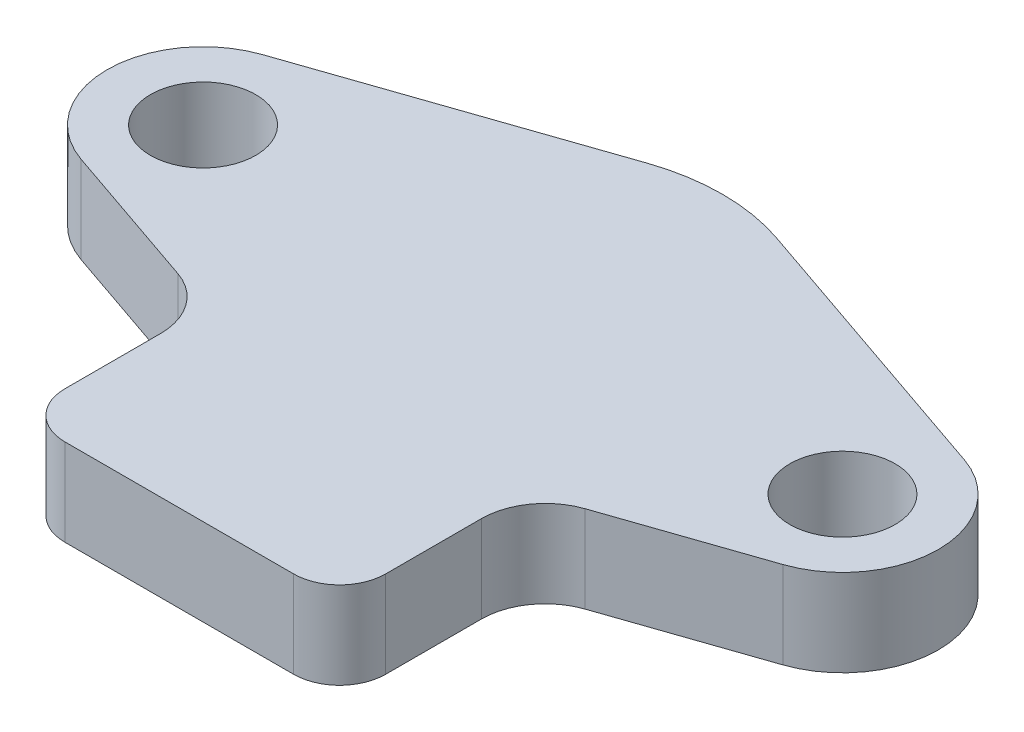
from build123d import *

# Parameters (mm, degrees)
BOSS_EXTRUDE1_DEPTH = 1.143
SKETCH2_R           = 2.6162
BOSS_EXTRUDE2_DEPTH = 3.175


with BuildPart() as part:
    # Sketch1 → Boss-Extrude1 (new body)
    with BuildSketch(Plane(origin=(0, 0, 0), x_dir=(1, 0, 0), z_dir=(0, 1, 0))):
        with BuildLine():
            Line((-7.9629, -10.019330915), (-7.9629, -14.7701))
            ThreePointArc((-7.9629, -14.7701), (-7.293346102, -16.386546102), (-5.6769, -17.0561))
            Line((-5.6769, -17.0561), (5.6769, -17.0561))
            ThreePointArc((5.6769, -17.0561), (7.293346102, -16.386546102), (7.9629, -14.7701))
            Line((7.9629, -14.7701), (7.9629, -10.019330915))
            ThreePointArc((7.9629, -10.019330915), (8.553832276, -8.174549356), (10.10666, -7.016470768))
            Line((10.10666, -7.016470768), (17.42186, -4.50429022))
            ThreePointArc((17.42186, -4.50429022), (20.6375, 0), (17.42186, 4.50429022))
            Line((17.42186, 4.50429022), (3.22159376, 9.380935099))
            ThreePointArc((3.22159376, 9.380935099), (1.633084309, 9.783335082), (0, 9.9187))
            ThreePointArc((0, 9.9187), (-1.633084309, 9.783335082), (-3.22159376, 9.380935099))
            Line((-3.22159376, 9.380935099), (-17.42186, 4.50429022))
            ThreePointArc((-17.42186, 4.50429022), (-20.6375, 0), (-17.42186, -4.50429022))
            Line((-17.42186, -4.50429022), (-10.10666, -7.016470768))
            ThreePointArc((-10.10666, -7.016470768), (-8.553832276, -8.174549356), (-7.9629, -10.019330915))
        make_face()
        with BuildLine():
            ThreePointArc((-15.875, 2.6162), (-18.4912, 0), (-15.875, -2.6162))
            ThreePointArc((-15.875, -2.6162), (-13.2588, 0), (-15.875, 2.6162))
        make_face(mode=Mode.SUBTRACT)
        with BuildLine():
            ThreePointArc((6.796505263, -4.818340964), (0, 8.3312), (-6.796505263, -4.818340964))
            ThreePointArc((-6.796505263, -4.818340964), (-6.483218951, -5.44667203), (-6.3754, -6.140446717))
            Line((-6.3754, -6.140446717), (-6.3754, -15.4686))
            Line((-6.3754, -15.4686), (6.3754, -15.4686))
            Line((6.3754, -15.4686), (6.3754, -9.7536))
            Line((6.3754, -9.7536), (6.3754, -6.140446717))
            ThreePointArc((6.3754, -6.140446717), (6.483218951, -5.44667203), (6.796505263, -4.818340964))
        make_face(mode=Mode.SUBTRACT)
        with BuildLine():
            ThreePointArc((15.875, 2.6162), (13.2588, 0), (15.875, -2.6162))
            ThreePointArc((15.875, -2.6162), (18.4912, 0), (15.875, 2.6162))
        make_face(mode=Mode.SUBTRACT)
    extrude(amount=BOSS_EXTRUDE1_DEPTH)

    # Sketch2 → Boss-Extrude2 (add)
    with BuildSketch(Plane(origin=(0, 1.143, 0), x_dir=(1, 0, 0), z_dir=(0, 1, 0))):
        with BuildLine():
            Line((-7.9629, -10.019330915), (-7.9629, -14.7701))
            ThreePointArc((-7.9629, -14.7701), (-7.293346102, -16.386546102), (-5.6769, -17.0561))
            Line((-5.6769, -17.0561), (5.6769, -17.0561))
            ThreePointArc((5.6769, -17.0561), (7.293346102, -16.386546102), (7.9629, -14.7701))
            Line((7.9629, -14.7701), (7.9629, -10.019330915))
            ThreePointArc((7.9629, -10.019330915), (8.553832276, -8.174549356), (10.10666, -7.016470768))
            Line((10.10666, -7.016470768), (17.42186, -4.50429022))
            ThreePointArc((17.42186, -4.50429022), (20.6375, 0), (17.42186, 4.50429022))
            Line((17.42186, 4.50429022), (3.22159376, 9.380935099))
            ThreePointArc((3.22159376, 9.380935099), (0, 9.9187), (-3.22159376, 9.380935099))
            Line((-3.22159376, 9.380935099), (-17.42186, 4.50429022))
            ThreePointArc((-17.42186, 4.50429022), (-20.6375, 0), (-17.42186, -4.50429022))
            Line((-17.42186, -4.50429022), (-10.10666, -7.016470768))
            ThreePointArc((-10.10666, -7.016470768), (-8.553832276, -8.174549356), (-7.9629, -10.019330915))
        make_face()
        with Locations(Location((15.875, 0, 0), (0, 0, 270))):
            Circle(SKETCH2_R, mode=Mode.SUBTRACT)
        with Locations(Location((-15.875, 0, 0), (0, 0, 270))):
            Circle(SKETCH2_R, mode=Mode.SUBTRACT)
    extrude(amount=BOSS_EXTRUDE2_DEPTH)


solid = part.part
